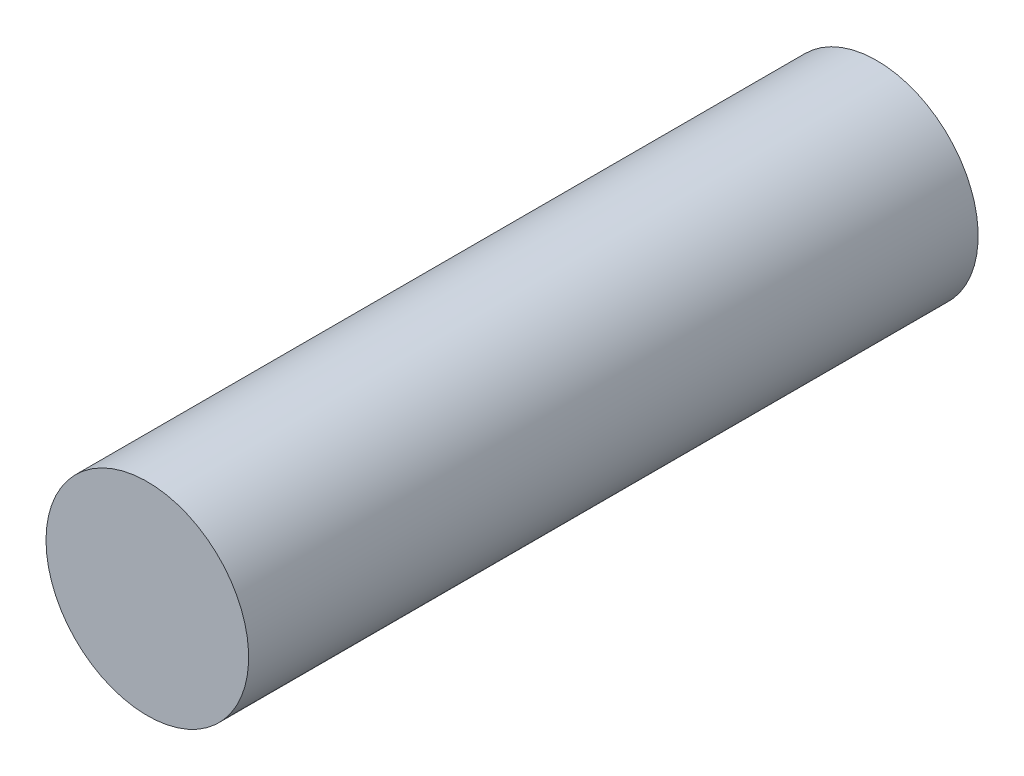
from build123d import *

# Parameters (mm, degrees)
SKETCH1_R           = 12.5
BOSS_EXTRUDE1_DEPTH = 90


with BuildPart() as part:
    # Sketch1 → Boss-Extrude1 (new body)
    with BuildSketch(Plane.XY):
        with Locations(Location((0, 0, 0), (0, 0, 180))):
            Circle(SKETCH1_R)
    extrude(amount=BOSS_EXTRUDE1_DEPTH)


solid = part.part
